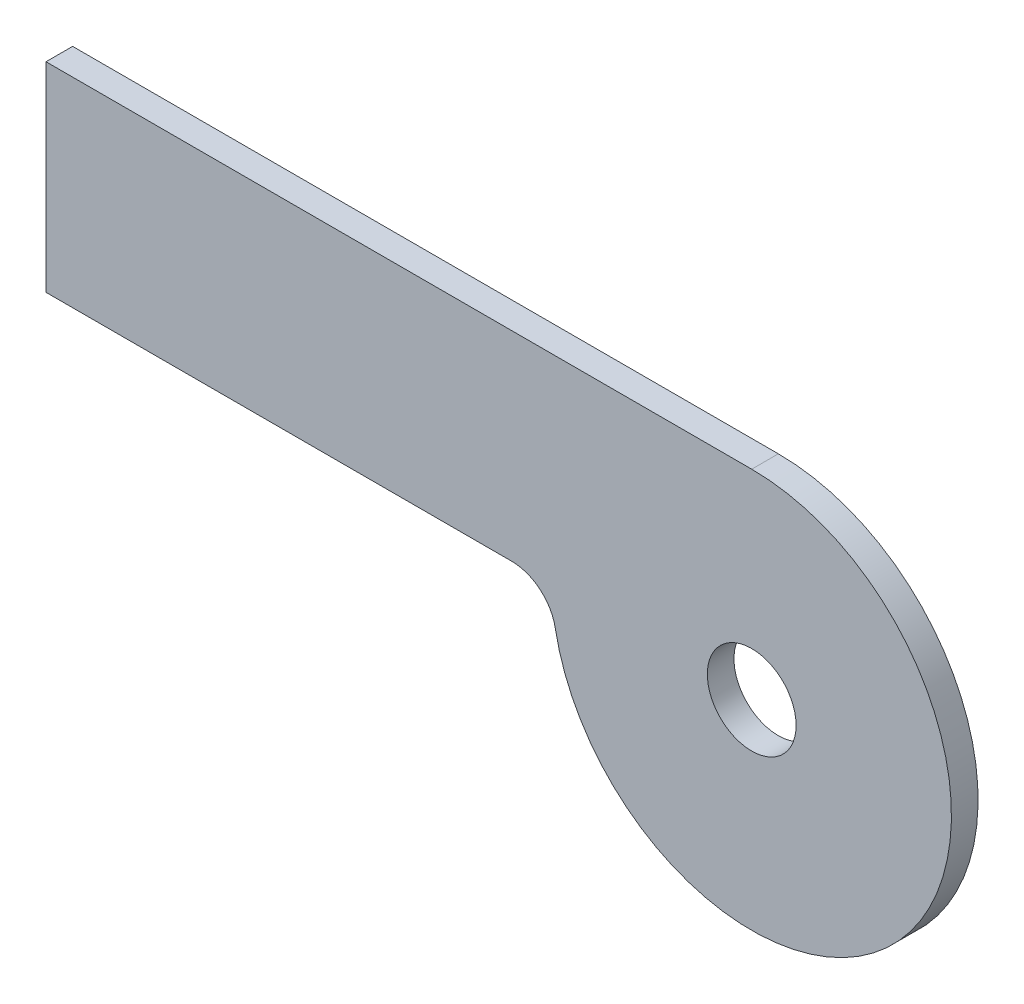
from build123d import *

# Parameters (mm, degrees)
SKETCH1_R           = 5
BOSS_EXTRUDE2_DEPTH = 3


with BuildPart() as part:
    # Sketch1 → Boss-Extrude2 (new body)
    # profile 1 of 6: a face of its own
    with BuildSketch(Plane.XY):
        with BuildLine():
            ThreePointArc((22.5, 0), (15.909902577, 15.909902577), (0, 22.5))
            Line((0, 22.5), (-22.5, 0))
            Line((-22.5, 0), (-22.124973736, -4.090909091))
            ThreePointArc((-22.124973736, -4.090909091), (2.054031517, -22.406047276), (22.5, 0))
        make_face()
        Circle(SKETCH1_R, mode=Mode.SUBTRACT)
    # profile 2 of 6: a face of its own
    with BuildSketch(Plane.XY):
        with BuildLine():
            ThreePointArc((-22.5, 0), (-15.909902577, 15.909902577), (0, 22.5))
            Line((0, 22.5), (-22.5, 22.5))
            Line((-22.5, 22.5), (-22.5, 0))
        make_face()
    # profile 3 of 6: a face of its own
    with BuildSketch(Plane.XY):
        with BuildLine():
            Line((-22.5, 0), (0, 22.5))
            ThreePointArc((0, 22.5), (-15.909902577, 15.909902577), (-22.5, 0))
        make_face()
    # profile 4 of 6: a face of its own
    with BuildSketch(Plane.XY):
        Polygon((-27.041634566, 0), (-22.5, 0), (-22.5, 22.5), (-79.5, 22.5), (-79.5, 0), align=None)
    # profile 5 of 6: a face of its own
    with BuildSketch(Plane.XY):
        with BuildLine():
            ThreePointArc((-22.124973736, -4.090909091), (-22.406047276, -2.054031517), (-22.5, 0))
            Line((-22.5, 0), (-27.041634566, 0))
            ThreePointArc((-27.041634566, 0), (-23.843623821, -1.156469426), (-22.124973736, -4.090909091))
        make_face()
    # profile 6 of 6: a face of its own
    with BuildSketch(Plane.XY):
        with BuildLine():
            Line((-22.124973736, -4.090909091), (-22.5, 0))
            ThreePointArc((-22.5, 0), (-22.406047276, -2.054031517), (-22.124973736, -4.090909091))
        make_face()
    extrude(amount=BOSS_EXTRUDE2_DEPTH)


solid = part.part
